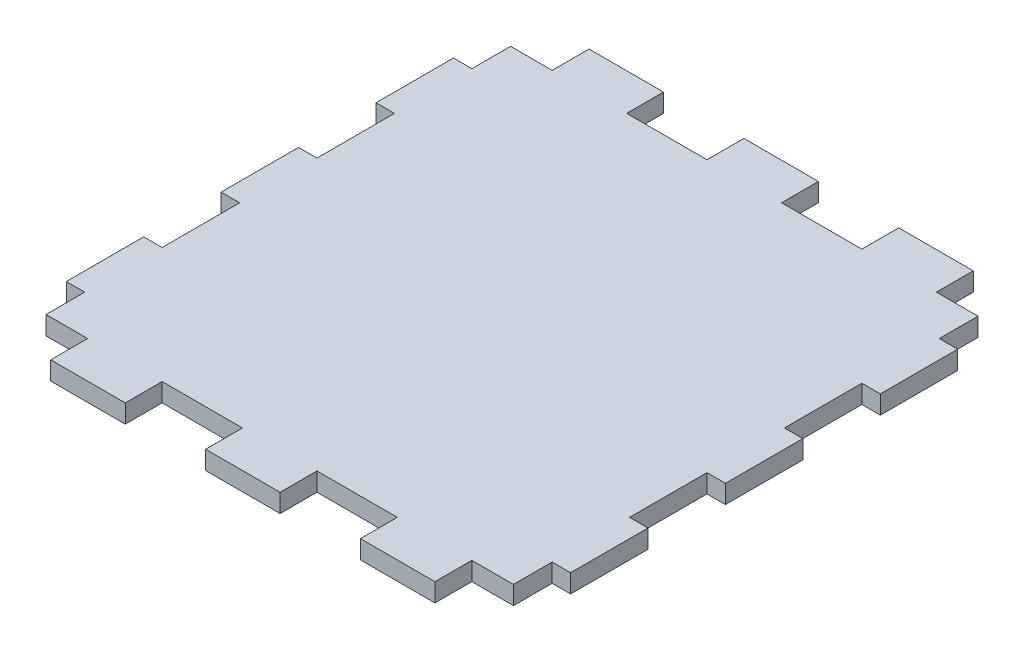
from build123d import *

# Parameters (mm, degrees)
BOSS_EXTRUDE1_DEPTH      = 1.5875
BOSS_EXTRUDE1_DEPTH_BACK = 1.5875
SKETCH3_W                = 0.25
SKETCH3_H                = 13.334960838
SKETCH3_H_2              = 13.334960839
CUT_EXTRUDE1_DEPTH       = 103.531394128
SKETCH4_W                = 0.25
SKETCH4_H                = 6.667480419
SKETCH4_H_2              = 13.334960838
BOSS_EXTRUDE2_DEPTH      = 3.175


with BuildPart() as part:
    # Sketch2 → Boss-Extrude1 (new, two sides: drawn at the far end of the back side and taken through both)
    with BuildSketch(Plane(origin=(0, -26.564964534, 0), x_dir=(1, 0, 0), z_dir=(0, 1, 0)).offset(-BOSS_EXTRUDE1_DEPTH_BACK)):
        Polygon((-40, -26.352441257), (-40, -39.687402095), (-43.675, -39.687402095), (-43.675, -53.022362934), (-40, -53.022362934), (-40, -66.357323772), (-43.675, -66.357323772), (-43.675, -79.69228461), (-40, -79.69228461), (-40, -86.359765029), (-33.083333333, -86.359765029), (-33.083333333, -92.709765029), (-20.25, -92.709765029), (-20.25, -86.359765029), (-6.416666667, -86.359765029), (-6.416666667, -92.709765029), (6.416666667, -92.709765029), (6.416666667, -86.359765029), (20.25, -86.359765029), (20.25, -92.709765029), (33.083333333, -92.709765029), (33.083333333, -86.359765029), (40, -86.359765029), (40, -79.69228461), (43.675, -79.69228461), (43.675, -66.357323772), (40, -66.357323772), (40, -53.022362934), (43.675, -53.022362934), (43.675, -39.687402095), (40, -39.687402095), (40, -26.352441257), (43.675, -26.352441257), (43.675, -13.017480419), (40, -13.017480419), (40, -6.35), (33.083333333, -6.35), (33.083333333, 0), (20.25, 0), (20.25, -6.35), (6.416666667, -6.35), (6.416666667, 0), (-6.416666667, 0), (-6.416666667, -6.35), (-20.25, -6.35), (-20.25, 0), (-33.083333333, 0), (-33.083333333, -6.35), (-40, -6.35), (-40, -13.017480419), (-43.675, -13.017480419), (-43.675, -26.352441257), align=None)
    extrude(amount=BOSS_EXTRUDE1_DEPTH + BOSS_EXTRUDE1_DEPTH_BACK)

    # Sketch3 → Cut-Extrude1 (cut, through all)
    with BuildSketch(Plane(origin=(0, -24.977464534, 0), x_dir=(1, 0, 0), z_dir=(0, 1, 0))):
        with Locations((-43.55, -19.684960838)):
            Rectangle(SKETCH3_W, SKETCH3_H)
        with Locations((-43.55, -46.354882515)):
            Rectangle(SKETCH3_W, SKETCH3_H_2)
        with Locations((-43.55, -73.024804191)):
            Rectangle(SKETCH3_W, SKETCH3_H)
        with Locations((43.55, -19.684960838)):
            Rectangle(SKETCH3_W, SKETCH3_H)
        with Locations((43.55, -46.354882515)):
            Rectangle(SKETCH3_W, SKETCH3_H_2)
        with Locations((43.55, -73.024804191)):
            Rectangle(SKETCH3_W, SKETCH3_H)
    extrude(amount=-CUT_EXTRUDE1_DEPTH, mode=Mode.SUBTRACT)

    # Sketch4 → Boss-Extrude2 (add)
    with BuildSketch(Plane(origin=(0, -24.977464534, 0), x_dir=(1, 0, 0), z_dir=(0, 1, 0))):
        with Locations((-40.125, -9.683740209)):
            Rectangle(SKETCH4_W, SKETCH4_H)
        with Locations((-40.125, -33.019921676)):
            Rectangle(SKETCH4_W, SKETCH4_H_2)
        with Locations((-40.125, -59.689843353)):
            Rectangle(SKETCH4_W, SKETCH4_H_2)
        with Locations((-40.125, -83.02602482)):
            Rectangle(SKETCH4_W, SKETCH4_H)
        with Locations((40.125, -83.02602482)):
            Rectangle(SKETCH4_W, SKETCH4_H)
        with Locations((40.125, -59.689843353)):
            Rectangle(SKETCH4_W, SKETCH4_H_2)
        with Locations((40.125, -33.019921676)):
            Rectangle(SKETCH4_W, SKETCH4_H_2)
        with Locations((40.125, -9.683740209)):
            Rectangle(SKETCH4_W, SKETCH4_H)
    extrude(amount=-BOSS_EXTRUDE2_DEPTH)


solid = part.part
